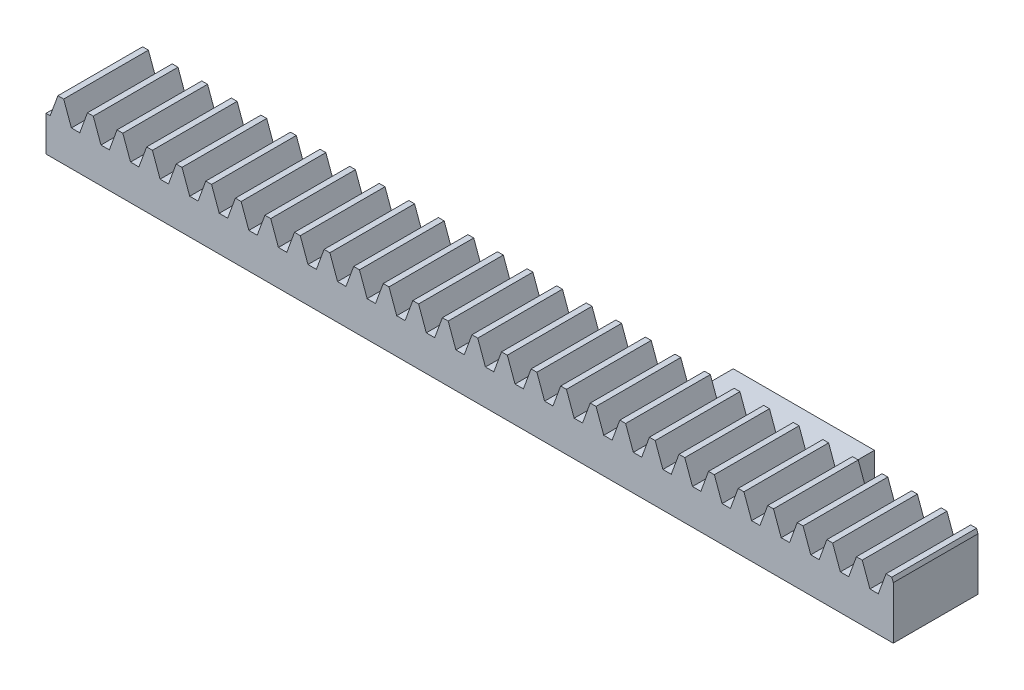
from build123d import *

# Parameters (mm, degrees)
BLANKSKE_W          = 90
BLANKSKE_H          = 6
BLANK_DEPTH         = 12
TOOTHCUTSIM_DEPTH   = 91.994505329
TEETHCUTS_COUNT     = 30
TEETHCUTS_PITCH     = 3.14159265
SKETCH3_W           = 91.493811728
SKETCH3_H           = 3
CUT_EXTRUDE3_DEPTH  = 10
SKETCH4_W           = 15
SKETCH4_H           = 3.75
BOSS_EXTRUDE1_DEPTH = 4


with BuildPart() as part:
    # BlankSke → Blank (new body)
    with BuildSketch(Plane.XY):
        with Locations((45, 3)):
            Rectangle(BLANKSKE_W, BLANKSKE_H)
    extrude(amount=-BLANK_DEPTH)

    # TooCutSkeSim → ToothCutSim (cut, through all)
    with BuildSketch(Plane.XY):
        Polygon((0.44443537, 3.75), (-0.44443537, 3.75), (-1.272613241, 6.0254), (1.272613241, 6.0254), align=None)
    toothcutsim = extrude(amount=-TOOTHCUTSIM_DEPTH, mode=Mode.SUBTRACT)

    # TeethCuts: ToothCutSim ×30
    with Locations(*[(i * TEETHCUTS_PITCH, 0, 0) for i in range(1, TEETHCUTS_COUNT)]):
        add(toothcutsim, mode=Mode.SUBTRACT)

    # Sketch3 → Cut-Extrude3 (cut)
    with BuildSketch(Plane(origin=(0, 0, 0), x_dir=(1, 0, 0), z_dir=(0, 1, 0))):
        with Locations((45.746905864, 10.5)):
            Rectangle(SKETCH3_W, SKETCH3_H)
    extrude(amount=CUT_EXTRUDE3_DEPTH, mode=Mode.SUBTRACT)

    # Sketch4 → Boss-Extrude1 (add)
    with BuildSketch(Plane(origin=(0, 0, -9), x_dir=(-1, 0, 0), z_dir=(0, 0, -1))):
        with Locations((-67.5, 1.875)):
            Rectangle(SKETCH4_W, SKETCH4_H)
    extrude(amount=BOSS_EXTRUDE1_DEPTH)


solid = part.part
